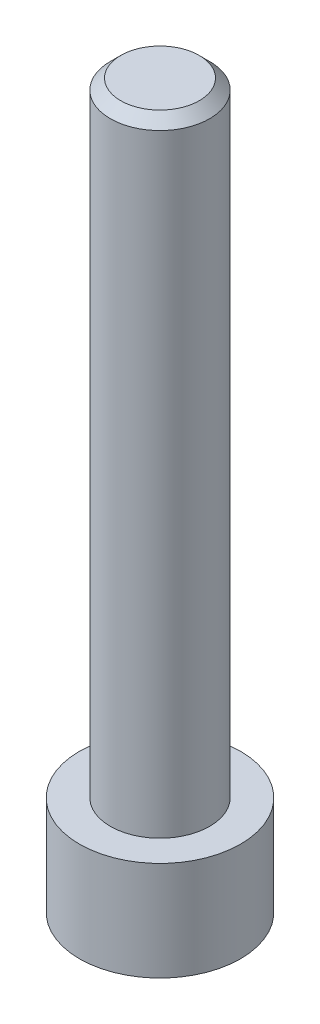
from build123d import *

# Parameters (mm, degrees)
SKETCH1_R           = 3.875
BOSS_EXTRUDE1_DEPTH = 34.78
SKETCH2_OUTSIDE_W   = 17.044
SKETCH2_OUTSIDE_H   = 17.044
SKETCH2_OUTSIDE_R   = 2.39
CUT_EXTRUDE1_DEPTH  = 30
CHAMFER1_SIZE       = 0.5
CUT_EXTRUDE2_DEPTH  = 3.36


with BuildPart() as part:
    # Sketch1 → Boss-Extrude1 (new body)
    with BuildSketch(Plane(origin=(0, 0, 0), x_dir=(1, 0, 0), z_dir=(0, 1, 0))):
        with Locations(Location((0, 0, 0), (0, 0, 270))):
            Circle(SKETCH1_R)
    extrude(amount=BOSS_EXTRUDE1_DEPTH)

    # Sketch2 outside → Cut-Extrude1 (cut)
    with BuildSketch(Plane(origin=(0, 34.78, 0), x_dir=(1, 0, 0), z_dir=(0, 1, 0))):
        Rectangle(SKETCH2_OUTSIDE_W, SKETCH2_OUTSIDE_H)
        with Locations(Location((0, 0, 0), (0, 0, 270))):
            Circle(SKETCH2_OUTSIDE_R, mode=Mode.SUBTRACT)
    extrude(amount=-CUT_EXTRUDE1_DEPTH, mode=Mode.SUBTRACT)

    # Chamfer1
    chamfer1_edges = [part.edges().sort_by_distance(p)[0] for p in [
        (0, 34.78, -2.39),
    ]]
    chamfer(chamfer1_edges, length=CHAMFER1_SIZE)

    # Sketch8 → Cut-Extrude2 (cut)
    with BuildSketch(Plane.XZ):
        Polygon((2.644264233, 0), (1.322132116, 2.29), (-1.322132116, 2.29), (-2.644264233, 0), (-1.322132116, -2.29), (1.322132116, -2.29), align=None)
    extrude(amount=-CUT_EXTRUDE2_DEPTH, mode=Mode.SUBTRACT)


solid = part.part
